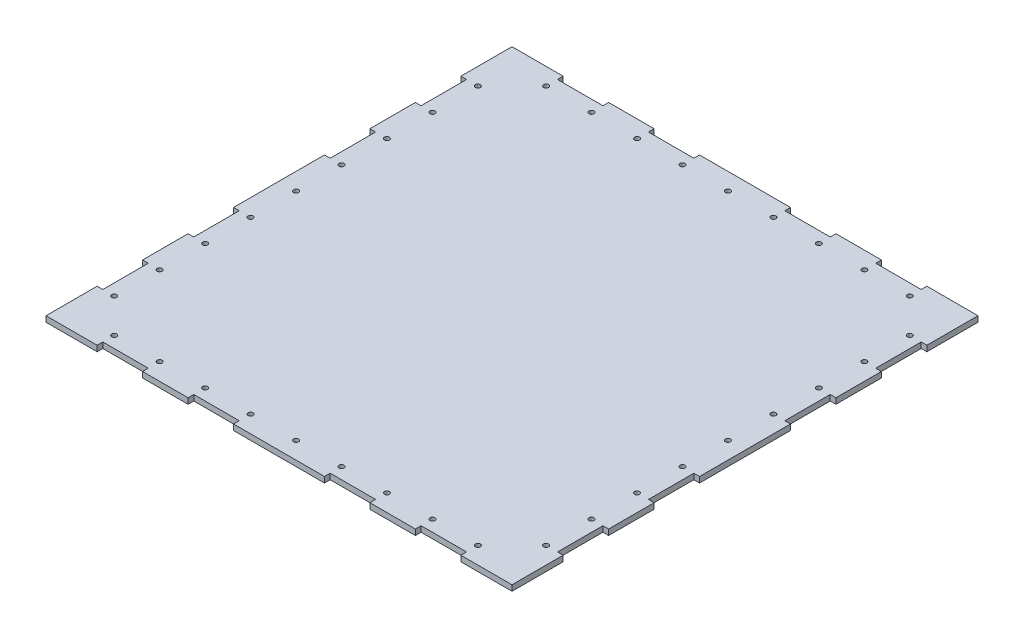
from build123d import *

# Parameters (mm, degrees)
SKETCH_1_R      = 2.2
EXTRUDE_1_DEPTH = 5


with BuildPart() as part:
    # 草图1 → 凸台-拉伸1 (new body)
    with BuildSketch(Plane(origin=(0, 0, 0), x_dir=(1, 0, 0), z_dir=(0, 1, 0))):
        Polygon((40, 200), (80, 200), (80, 205), (120, 205), (120, 200), (160, 200), (160, 205), (200, 205), (205, 205), (205, 200), (205, 160), (200, 160), (200, 120), (205, 120), (205, 80), (200, 80), (200, 40), (205, 40), (205, -40), (200, -40), (200, -80), (205, -80), (205, -120), (200, -120), (200, -160), (205, -160), (205, -200), (205, -205), (200, -205), (160, -205), (160, -200), (120, -200), (120, -205), (80, -205), (80, -200), (40, -200), (40, -205), (-40, -205), (-40, -200), (-80, -200), (-80, -205), (-120, -205), (-120, -200), (-160, -200), (-160, -205), (-200, -205), (-205, -205), (-205, -200), (-205, -160), (-200, -160), (-200, -120), (-205, -120), (-205, -80), (-200, -80), (-200, -40), (-205, -40), (-205, 40), (-200, 40), (-200, 80), (-205, 80), (-205, 120), (-200, 120), (-200, 160), (-205, 160), (-205, 200), (-205, 205), (-200, 205), (-160, 205), (-160, 200), (-120, 200), (-120, 205), (-80, 205), (-80, 200), (-40, 200), (-40, 205), (40, 205), align=None)
        with Locations(Location((-190, 0, 0), (0, 0, 270))):
            Circle(SKETCH_1_R, mode=Mode.SUBTRACT)
        with Locations(Location((-190, 40, 0), (0, 0, 270))):
            Circle(SKETCH_1_R, mode=Mode.SUBTRACT)
        with Locations(Location((-190, 80, 0), (0, 0, 270))):
            Circle(SKETCH_1_R, mode=Mode.SUBTRACT)
        with Locations(Location((-190, 120, 0), (0, 0, 270))):
            Circle(SKETCH_1_R, mode=Mode.SUBTRACT)
        with Locations(Location((-190, 160, 0), (0, 0, 270))):
            Circle(SKETCH_1_R, mode=Mode.SUBTRACT)
        with Locations(Location((-190, -160, 0), (0, 0, 270))):
            Circle(SKETCH_1_R, mode=Mode.SUBTRACT)
        with Locations(Location((-190, -120, 0), (0, 0, 270))):
            Circle(SKETCH_1_R, mode=Mode.SUBTRACT)
        with Locations(Location((-190, -80, 0), (0, 0, 270))):
            Circle(SKETCH_1_R, mode=Mode.SUBTRACT)
        with Locations(Location((-190, -40, 0), (0, 0, 270))):
            Circle(SKETCH_1_R, mode=Mode.SUBTRACT)
        with Locations(Location((0, 190, 0), (0, 0, 270))):
            Circle(SKETCH_1_R, mode=Mode.SUBTRACT)
        with Locations(Location((40, 190, 0), (0, 0, 270))):
            Circle(SKETCH_1_R, mode=Mode.SUBTRACT)
        with Locations(Location((80, 190, 0), (0, 0, 270))):
            Circle(SKETCH_1_R, mode=Mode.SUBTRACT)
        with Locations(Location((120, 190, 0), (0, 0, 270))):
            Circle(SKETCH_1_R, mode=Mode.SUBTRACT)
        with Locations(Location((160, 190, 0), (0, 0, 270))):
            Circle(SKETCH_1_R, mode=Mode.SUBTRACT)
        with Locations(Location((-160, 190, 0), (0, 0, 270))):
            Circle(SKETCH_1_R, mode=Mode.SUBTRACT)
        with Locations(Location((-120, 190, 0), (0, 0, 270))):
            Circle(SKETCH_1_R, mode=Mode.SUBTRACT)
        with Locations(Location((-80, 190, 0), (0, 0, 270))):
            Circle(SKETCH_1_R, mode=Mode.SUBTRACT)
        with Locations(Location((-40, 190, 0), (0, 0, 270))):
            Circle(SKETCH_1_R, mode=Mode.SUBTRACT)
        with Locations(Location((190, 0, 0), (0, 0, 270))):
            Circle(SKETCH_1_R, mode=Mode.SUBTRACT)
        with Locations(Location((190, -40, 0), (0, 0, 270))):
            Circle(SKETCH_1_R, mode=Mode.SUBTRACT)
        with Locations(Location((190, -80, 0), (0, 0, 270))):
            Circle(SKETCH_1_R, mode=Mode.SUBTRACT)
        with Locations(Location((190, -120, 0), (0, 0, 270))):
            Circle(SKETCH_1_R, mode=Mode.SUBTRACT)
        with Locations(Location((190, -160, 0), (0, 0, 270))):
            Circle(SKETCH_1_R, mode=Mode.SUBTRACT)
        with Locations(Location((190, 160, 0), (0, 0, 270))):
            Circle(SKETCH_1_R, mode=Mode.SUBTRACT)
        with Locations(Location((190, 120, 0), (0, 0, 270))):
            Circle(SKETCH_1_R, mode=Mode.SUBTRACT)
        with Locations(Location((190, 80, 0), (0, 0, 270))):
            Circle(SKETCH_1_R, mode=Mode.SUBTRACT)
        with Locations(Location((190, 40, 0), (0, 0, 270))):
            Circle(SKETCH_1_R, mode=Mode.SUBTRACT)
        with Locations(Location((0, -190, 0), (0, 0, 270))):
            Circle(SKETCH_1_R, mode=Mode.SUBTRACT)
        with Locations(Location((-40, -190, 0), (0, 0, 270))):
            Circle(SKETCH_1_R, mode=Mode.SUBTRACT)
        with Locations(Location((-80, -190, 0), (0, 0, 270))):
            Circle(SKETCH_1_R, mode=Mode.SUBTRACT)
        with Locations(Location((-120, -190, 0), (0, 0, 270))):
            Circle(SKETCH_1_R, mode=Mode.SUBTRACT)
        with Locations(Location((-160, -190, 0), (0, 0, 270))):
            Circle(SKETCH_1_R, mode=Mode.SUBTRACT)
        with Locations(Location((160, -190, 0), (0, 0, 270))):
            Circle(SKETCH_1_R, mode=Mode.SUBTRACT)
        with Locations(Location((120, -190, 0), (0, 0, 270))):
            Circle(SKETCH_1_R, mode=Mode.SUBTRACT)
        with Locations(Location((80, -190, 0), (0, 0, 270))):
            Circle(SKETCH_1_R, mode=Mode.SUBTRACT)
        with Locations(Location((40, -190, 0), (0, 0, 270))):
            Circle(SKETCH_1_R, mode=Mode.SUBTRACT)
    extrude(amount=EXTRUDE_1_DEPTH)


solid = part.part
